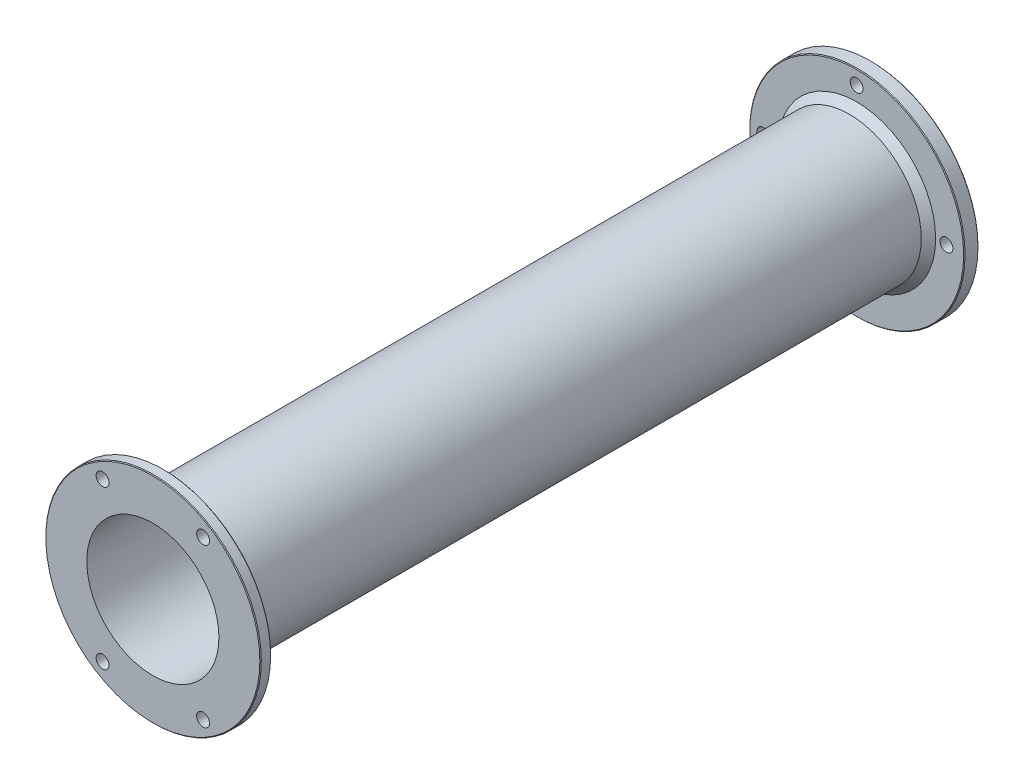
from build123d import *

# Parameters (mm, degrees)
SKIZZE1_R                       = 150
SKIZZE1_R_2                     = 92
SKIZZE1_R_3                     = 9
AUFSATZ_LINEAR_AUSTRAGEN1_DEPTH = 20
SKIZZE2_R                       = 100
SKIZZE2_R_2                     = 92
AUFSATZ_LINEAR_AUSTRAGEN2_DEPTH = 965
SKIZZE3_R                       = 150
SKIZZE3_R_2                     = 92
SKIZZE3_R_3                     = 9
AUFSATZ_LINEAR_AUSTRAGEN3_DEPTH = 15
FASE1_SIZE                      = 10
FASE2_SIZE                      = 1


with BuildPart() as part:
    # Skizze1 → Aufsatz-Linear austragen1 (new body)
    with BuildSketch(Plane.XY):
        Circle(SKIZZE1_R)
        Circle(SKIZZE1_R_2, mode=Mode.SUBTRACT)
        with Locations((0, 130)):
            Circle(SKIZZE1_R_3, mode=Mode.SUBTRACT)
        with Locations((125, 0)):
            Circle(SKIZZE1_R_3, mode=Mode.SUBTRACT)
        with Locations((-5, -125)):
            Circle(SKIZZE1_R_3, mode=Mode.SUBTRACT)
        with Locations((-130, 5)):
            Circle(SKIZZE1_R_3, mode=Mode.SUBTRACT)
    extrude(amount=AUFSATZ_LINEAR_AUSTRAGEN1_DEPTH)

    # Skizze2 → Aufsatz-Linear austragen2 (add)
    with BuildSketch(Plane.XY.offset(20)):
        Circle(SKIZZE2_R)
        Circle(SKIZZE2_R_2, mode=Mode.SUBTRACT)
    extrude(amount=AUFSATZ_LINEAR_AUSTRAGEN2_DEPTH)

    # Skizze3 → Aufsatz-Linear austragen3 (add)
    with BuildSketch(Plane.XY.offset(985)):
        Circle(SKIZZE3_R)
        Circle(SKIZZE3_R_2, mode=Mode.SUBTRACT)
        with Locations((-70, 110)):
            Circle(SKIZZE3_R_3, mode=Mode.SUBTRACT)
        with Locations((70, 110)):
            Circle(SKIZZE3_R_3, mode=Mode.SUBTRACT)
        with Locations((70, -110)):
            Circle(SKIZZE3_R_3, mode=Mode.SUBTRACT)
        with Locations((-70, -110)):
            Circle(SKIZZE3_R_3, mode=Mode.SUBTRACT)
    extrude(amount=AUFSATZ_LINEAR_AUSTRAGEN3_DEPTH)

    # Fase1
    fase1_edges = [part.edges().sort_by_distance(p)[0] for p in [
        (-100, 0, 985),
        (-100, 0, 20),
    ]]
    chamfer(fase1_edges, length=FASE1_SIZE)

    # Fase2
    fase2_edges = [part.edges().sort_by_distance(p)[0] for p in [
        (-150, 0, 0),
        (-150, 0, 1000),
        (-150, 0, 985),
        (-150, 0, 20),
    ]]
    chamfer(fase2_edges, length=FASE2_SIZE)


solid = part.part
